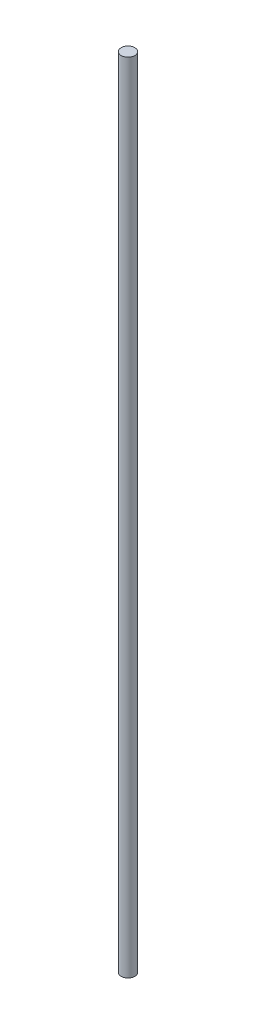
from build123d import *

# Parameters (mm, degrees)
SKETCH1_R           = 3
BOSS_EXTRUDE1_DEPTH = 350


with BuildPart() as part:
    # Sketch1 → Boss-Extrude1 (new body)
    with BuildSketch(Plane(origin=(0, 0, 0), x_dir=(1, 0, 0), z_dir=(0, 1, 0))):
        with Locations(Location((0, 0, 0), (0, 0, 270))):
            Circle(SKETCH1_R)
    extrude(amount=BOSS_EXTRUDE1_DEPTH)


solid = part.part
